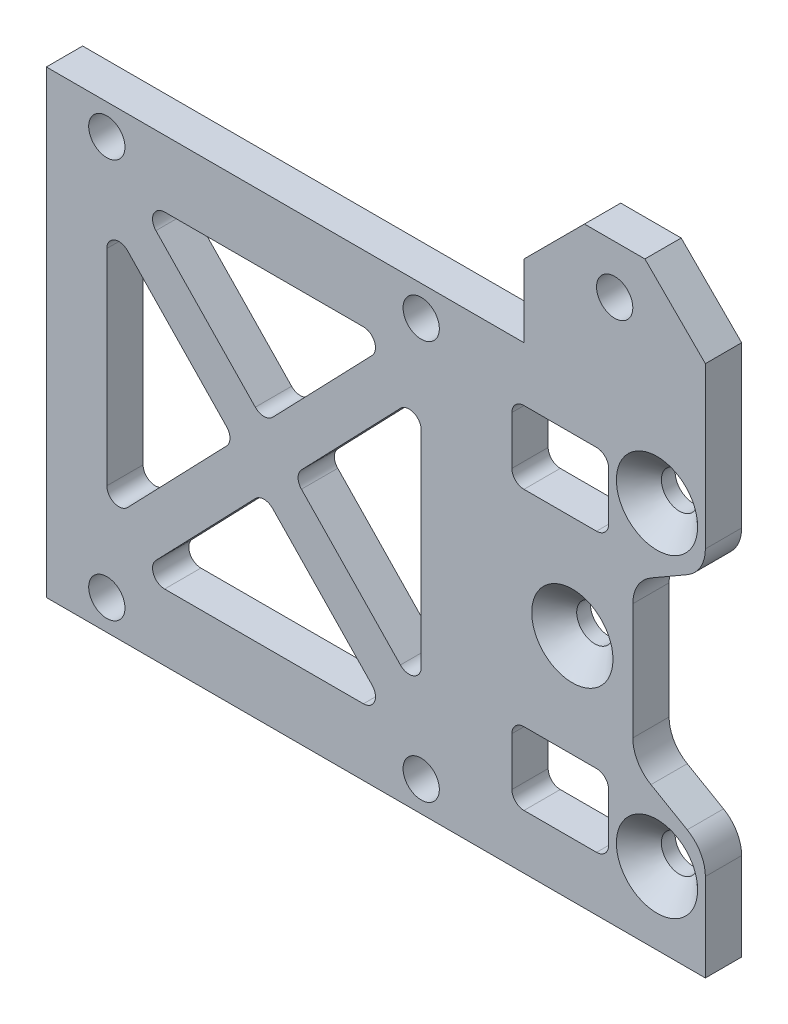
from build123d import *

# Parameters (mm, degrees)
SKETCH_1_R                  = 1.5
SKETCH_1_W                  = 8
SKETCH_1_H                  = 6
EXTRUDE_1_DEPTH             = 3
HOLE_WIZARD_M3_1_AT_2_COUNT = 2
HOLE_WIZARD_M3_1_AT_2_PITCH = 14.76482306
HOLE_WIZARD_M3_1_AT_3_COUNT = 2
HOLE_WIZARD_M3_1_AT_3_PITCH = 26
FILLET_1_R                  = 1
CHAMFER_1_SIZE              = 5
FILLET_2_R                  = 3


with BuildPart() as part:
    # 草图1 → 凸台-拉伸1 (new body)
    with BuildSketch(Plane.XY):
        Polygon((36.5, -19), (-18, -19), (-18, 19), (21.5, 19), (21.5, 30), (36.5, 30), (36.5, 19), (36.5, 10), (30.5, 6.535898385), (30.5, -6.535898385), (36.5, -10), align=None)
        with Locations((-13, 16.5)):
            Circle(SKETCH_1_R, mode=Mode.SUBTRACT)
        with Locations((-13, -16.5)):
            Circle(SKETCH_1_R, mode=Mode.SUBTRACT)
        with Locations((13, -16.5)):
            Circle(SKETCH_1_R, mode=Mode.SUBTRACT)
        with Locations((13, 16.5)):
            Circle(SKETCH_1_R, mode=Mode.SUBTRACT)
        with Locations((32.5, -13)):
            Circle(SKETCH_1_R, mode=Mode.SUBTRACT)
        with Locations(Location((32.5, 13, 0), (0, 0, 180))):
            Circle(SKETCH_1_R, mode=Mode.SUBTRACT)
        with Locations((25.5, 0)):
            Circle(SKETCH_1_R, mode=Mode.SUBTRACT)
        with Locations((29, 26)):
            Circle(SKETCH_1_R, mode=Mode.SUBTRACT)
        with Locations((24.5, -11.5)):
            Rectangle(SKETCH_1_W, SKETCH_1_H, mode=Mode.SUBTRACT)
        with Locations((24.5, 11.5)):
            Rectangle(SKETCH_1_W, SKETCH_1_H, mode=Mode.SUBTRACT)
        Polygon((-13, -10.977083583), (-2.429475068, 0), (-13, 10.977083583), align=None, mode=Mode.SUBTRACT)
        Polygon((-10.570524932, -13.5), (0, -2.522916417), (10.570524932, -13.5), align=None, mode=Mode.SUBTRACT)
        Polygon((-10.570524932, 13.5), (0, 2.522916417), (10.570524932, 13.5), align=None, mode=Mode.SUBTRACT)
        Polygon((2.429475068, 0), (13, 10.977083583), (13, -10.977083583), align=None, mode=Mode.SUBTRACT)
    extrude(amount=EXTRUDE_1_DEPTH)

    # 草图2 → M3 六角凹锥坑螺钉的锥形沉头孔1 (revolve, cut)
    with BuildSketch(Plane(origin=(32.5, 13, 3), x_dir=(0, -1, 0), z_dir=(1, 0, 0))):
        Polygon((0, 0), (0, 3), (1.5, 3), (1.5, 1.86), (3.36, 0), align=None)
    hole_wizard_m3_1 = revolve(axis=Axis((32.5, 13, 9.35), (0, 0, -1)), mode=Mode.SUBTRACT)

    # M3 六角凹锥坑螺钉的锥形沉头孔1 at 2: M3 六角凹锥坑螺钉的锥形沉头孔1 ×2
    with Locations(*[Vector(-0.4740998230350173, -0.8804710999221754, 0) * (i * HOLE_WIZARD_M3_1_AT_2_PITCH) for i in range(1, HOLE_WIZARD_M3_1_AT_2_COUNT)]):
        add(hole_wizard_m3_1, mode=Mode.SUBTRACT)

    # M3 六角凹锥坑螺钉的锥形沉头孔1 at 3: M3 六角凹锥坑螺钉的锥形沉头孔1 ×2
    with Locations(*[(0, -i * HOLE_WIZARD_M3_1_AT_3_PITCH, 0) for i in range(1, HOLE_WIZARD_M3_1_AT_3_COUNT)]):
        add(hole_wizard_m3_1, mode=Mode.SUBTRACT)

    # 圆角1
    fillet_1_edges = [part.edges().sort_by_distance(p)[0] for p in [
        (-10.570524932, -13.5, 1.5),
        (10.570524932, -13.5, 1.5),
        (0, -2.522916417, 1.5),
        (13, -10.977083583, 1.5),
        (13, 10.977083583, 1.5),
        (2.429475068, 0, 1.5),
        (28.5, -8.5, 1.5),
        (20.5, -8.5, 1.5),
        (20.5, -14.5, 1.5),
        (28.5, -14.5, 1.5),
        (20.5, 14.5, 1.5),
        (20.5, 8.5, 1.5),
        (28.5, 8.5, 1.5),
        (28.5, 14.5, 1.5),
        (-13, 10.977083583, 1.5),
        (-13, -10.977083583, 1.5),
        (-2.429475068, 0, 1.5),
        (10.570524932, 13.5, 1.5),
        (-10.570524932, 13.5, 1.5),
        (0, 2.522916417, 1.5),
    ]]
    fillet(fillet_1_edges, radius=FILLET_1_R)

    # 倒角1
    chamfer_1_edges = [part.edges().sort_by_distance(p)[0] for p in [
        (21.5, 30, 1.5),
        (36.5, 30, 1.5),
    ]]
    chamfer(chamfer_1_edges, length=CHAMFER_1_SIZE)

    # 圆角2
    fillet_2_edges = [part.edges().sort_by_distance(p)[0] for p in [
        (36.5, 10, 1.5),
        (30.5, 6.535898385, 1.5),
        (30.5, -6.535898385, 1.5),
        (36.5, -10, 1.5),
    ]]
    fillet(fillet_2_edges, radius=FILLET_2_R)


solid = part.part
